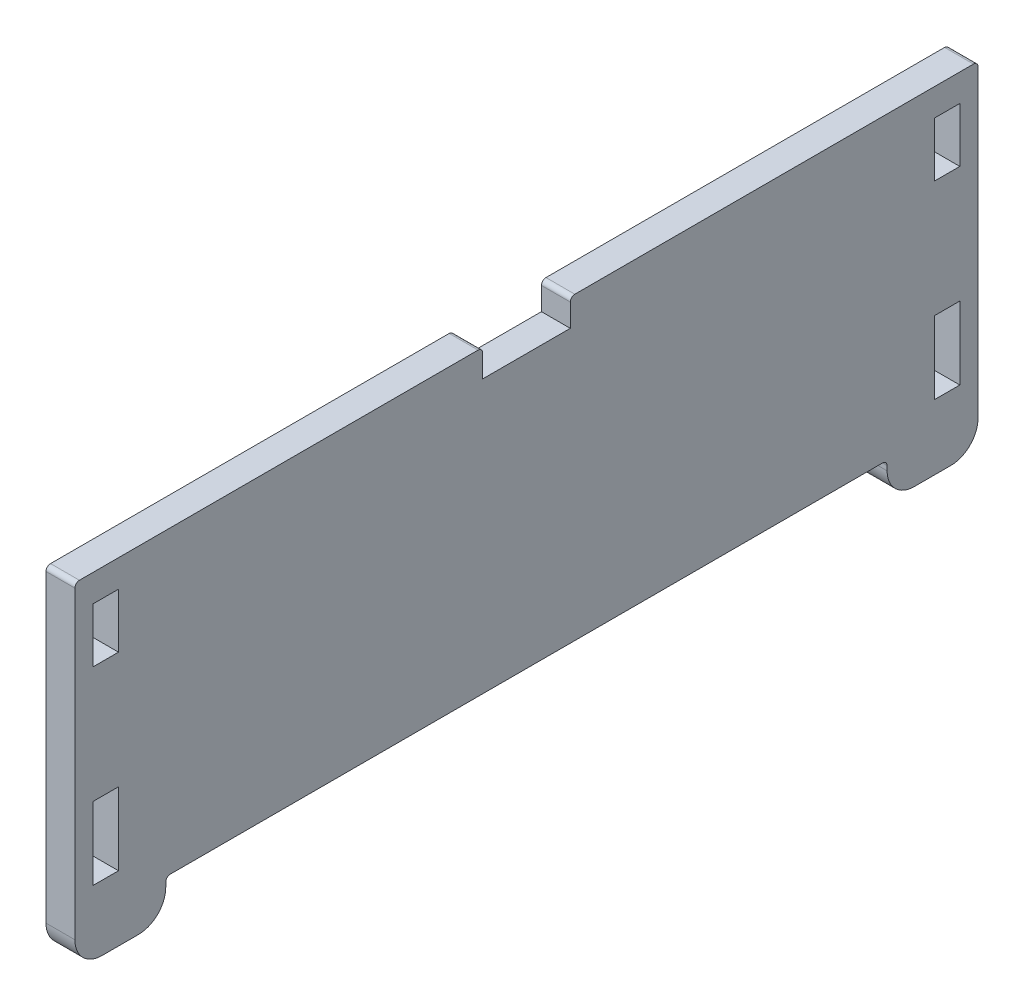
from build123d import *

# Parameters (mm, degrees)
SKETCH1_W           = 99.35
SKETCH1_H           = 37
BOSS_EXTRUDE1_DEPTH = 3.175
SKETCH2_W           = 2.8
SKETCH2_H           = 6
SKETCH2_H_2         = 8
CUT_EXTRUDE1_DEPTH  = 54.103071945
SKETCH3_W           = 79.35
SKETCH3_H           = 4
CUT_EXTRUDE2_DEPTH  = 54.103071945
FILLET1_R           = 3
FILLET2_R           = 0.5
SKETCH4_W           = 9.65
SKETCH4_H           = 3
CUT_EXTRUDE3_DEPTH  = 54.103071945
FILLET3_R           = 0.5


with BuildPart() as part:
    # Sketch1 → Boss-Extrude1 (new body)
    with BuildSketch(Plane(origin=(0, 0, 0), x_dir=(0, 0, -1), z_dir=(1, 0, 0))):
        Rectangle(SKETCH1_W, SKETCH1_H)
    extrude(amount=BOSS_EXTRUDE1_DEPTH)

    # Sketch2 → Cut-Extrude1 (cut, through all)
    with BuildSketch(Plane(origin=(3.175, 0, 0), x_dir=(0, 0, -1), z_dir=(1, 0, 0))):
        with Locations((-46.275, 12.5)):
            Rectangle(SKETCH2_W, SKETCH2_H)
        with Locations((46.275, 12.5)):
            Rectangle(SKETCH2_W, SKETCH2_H)
        with Locations((-46.275, -7.325)):
            Rectangle(SKETCH2_W, SKETCH2_H_2)
        with Locations((46.275, -7.325)):
            Rectangle(SKETCH2_W, SKETCH2_H_2)
    extrude(amount=-CUT_EXTRUDE1_DEPTH, mode=Mode.SUBTRACT)

    # Sketch3 → Cut-Extrude2 (cut, through all)
    with BuildSketch(Plane(origin=(3.175, 0, 0), x_dir=(0, 0, -1), z_dir=(1, 0, 0))):
        with Locations((0, -16.5)):
            Rectangle(SKETCH3_W, SKETCH3_H)
    extrude(amount=-CUT_EXTRUDE2_DEPTH, mode=Mode.SUBTRACT)

    # Fillet1
    fillet1_edges = [part.edges().sort_by_distance(p)[0] for p in [
        (1.5875, -18.5, -49.675),
        (1.5875, -18.5, 49.675),
        (1.5875, -18.5, 39.675),
        (1.5875, -18.5, -39.675),
    ]]
    fillet(fillet1_edges, radius=FILLET1_R)

    # Fillet2
    fillet2_edges = [part.edges().sort_by_distance(p)[0] for p in [
        (1.5875, 18.5, 49.675),
        (1.5875, 18.5, -49.675),
        (1.5875, -14.5, 39.675),
        (1.5875, -14.5, -39.675),
    ]]
    fillet(fillet2_edges, radius=FILLET2_R)

    # Sketch4 → Cut-Extrude3 (cut, through all)
    with BuildSketch(Plane(origin=(3.175, 0, 0), x_dir=(0, 0, -1), z_dir=(1, 0, 0))):
        with Locations((0, 17)):
            Rectangle(SKETCH4_W, SKETCH4_H)
    extrude(amount=-CUT_EXTRUDE3_DEPTH, mode=Mode.SUBTRACT)

    # Fillet3
    fillet3_edges = [part.edges().sort_by_distance(p)[0] for p in [
        (1.5875, 18.5, 4.825),
        (1.5875, 18.5, -4.825),
    ]]
    fillet(fillet3_edges, radius=FILLET3_R)


solid = part.part
